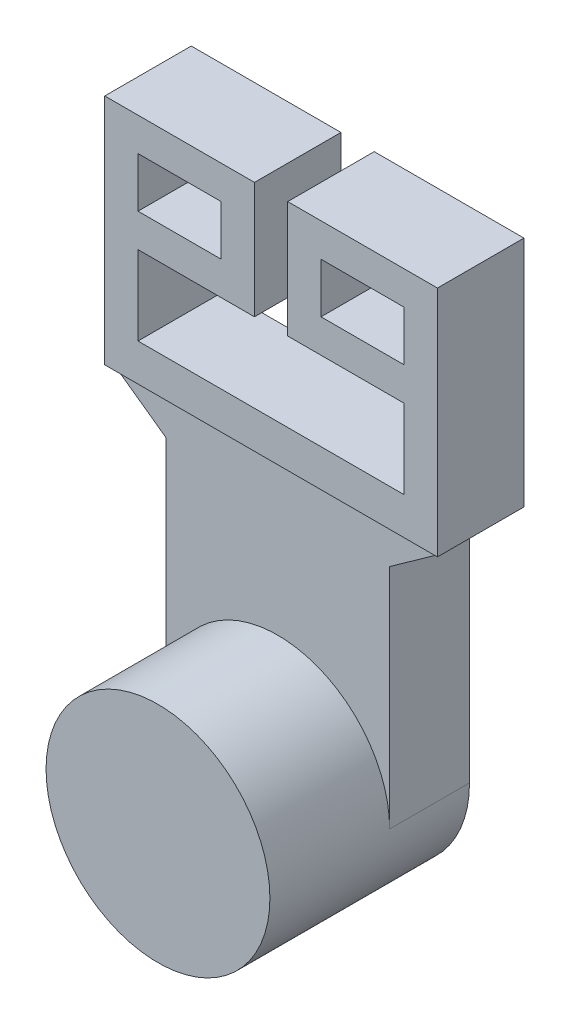
from build123d import *

# Parameters (mm, degrees)
SKETCH1_R           = 10.6807
BOSS_EXTRUDE1_DEPTH = 19.05
SKETCH2_W           = 21.3614
SKETCH2_H           = 25.4
BOSS_EXTRUDE2_DEPTH = 7.62
BOSS_EXTRUDE3_DEPTH = 3.556
SKETCH4_W           = 15.875
SKETCH4_H           = 22.225
BOSS_EXTRUDE4_DEPTH = 3.175
SKETCH5_W           = 15.875
SKETCH5_H           = 22.225
BOSS_EXTRUDE5_DEPTH = 3.175
SKETCH7_W           = 15.875
SKETCH7_H           = 11.1125
BOSS_EXTRUDE6_DEPTH = 11.1125
SKETCH8_W           = 15.875
SKETCH8_H           = 11.1125
BOSS_EXTRUDE7_DEPTH = 11.1125
SKETCH9_W           = 31.75
SKETCH9_H           = 22.225
CUT_EXTRUDE1_DEPTH  = 7.62
BOSS_EXTRUDE8_DEPTH = 7.62
CUT_EXTRUDE2_REACH  = 53.349
SKETCH11_W          = 7.9375
SKETCH11_H          = 4.7625


with BuildPart() as part:
    # Sketch1 → Boss-Extrude1 (new body)
    with BuildSketch(Plane.XY):
        with Locations(Location((0, 0, 0), (0, 0, 180))):
            Circle(SKETCH1_R)
    extrude(amount=BOSS_EXTRUDE1_DEPTH)

    # Sketch2 → Boss-Extrude2 (add)
    with BuildSketch(Plane(origin=(0, 0, 0), x_dir=(-1, 0, 0), z_dir=(0, 0, -1))):
        with Locations((0, 12.7)):
            Rectangle(SKETCH2_W, SKETCH2_H)
    extrude(amount=-BOSS_EXTRUDE2_DEPTH)

    # Sketch3 → Boss-Extrude3 (add)
    with BuildSketch(Plane(origin=(0, 25.4, 0), x_dir=(1, 0, 0), z_dir=(0, 1, 0))):
        Polygon((0, 0), (12.7, 0), (12.7, -15.875), (-12.7, -15.875), (-12.7, 0), align=None)
    extrude(amount=BOSS_EXTRUDE3_DEPTH)

    # Sketch4 → Boss-Extrude4 (add)
    with BuildSketch(Plane(origin=(12.7, 0, 0), x_dir=(0, 0, -1), z_dir=(1, 0, 0))):
        with Locations((-7.9375, 36.5125)):
            Rectangle(SKETCH4_W, SKETCH4_H)
    extrude(amount=BOSS_EXTRUDE4_DEPTH)

    # Sketch5 → Boss-Extrude5 (add)
    with BuildSketch(Plane.ZY.offset(12.7)):
        with Locations((7.9375, 36.5125)):
            Rectangle(SKETCH5_W, SKETCH5_H)
    extrude(amount=BOSS_EXTRUDE5_DEPTH)

    # Sketch7 → Boss-Extrude6 (add)
    with BuildSketch(Plane(origin=(-12.7, 0, 0), x_dir=(0, 0, -1), z_dir=(1, 0, 0))):
        with Locations((-7.9375, 42.06875)):
            Rectangle(SKETCH7_W, SKETCH7_H)
    extrude(amount=BOSS_EXTRUDE6_DEPTH)

    # Sketch8 → Boss-Extrude7 (add)
    with BuildSketch(Plane.ZY.offset(-12.7)):
        with Locations((7.9375, 42.06875)):
            Rectangle(SKETCH8_W, SKETCH8_H)
    extrude(amount=BOSS_EXTRUDE7_DEPTH)

    # Sketch9 → Cut-Extrude1 (cut)
    with BuildSketch(Plane.XY.offset(15.875)):
        with Locations((0, 36.5125)):
            Rectangle(SKETCH9_W, SKETCH9_H)
    extrude(amount=-CUT_EXTRUDE1_DEPTH, mode=Mode.SUBTRACT)

    # Sketch10 → Boss-Extrude8 (add)
    with BuildSketch(Plane(origin=(0, 0, 0), x_dir=(-1, 0, 0), z_dir=(0, 0, -1))):
        Polygon((-10.6807, 25.4), (-15.875, 25.4), (-10.6807, 21.684330036), align=None)
        Polygon((15.875, 25.4), (10.6807, 21.684330036), (10.6807, 25.4), align=None)
    extrude(amount=-BOSS_EXTRUDE8_DEPTH)

    # Sketch11 → Cut-Extrude2 (cut, up to next)
    with BuildSketch(Plane.XY.offset(8.255), mode=Mode.PRIVATE) as cut_extrude2_sk1:
        with Locations((8.73125, 42.06875)):
            Rectangle(SKETCH11_W, SKETCH11_H)
    cut_extrude2_tool1 = extrude(cut_extrude2_sk1.sketch, amount=-CUT_EXTRUDE2_REACH, mode=Mode.PRIVATE) & part.part
    # Sketch11 → Cut-Extrude2 (cut, up to next)
    with BuildSketch(Plane.XY.offset(8.255), mode=Mode.PRIVATE) as cut_extrude2_sk2:
        with Locations((-8.73125, 42.06875)):
            Rectangle(SKETCH11_W, SKETCH11_H)
    cut_extrude2_tool2 = extrude(cut_extrude2_sk2.sketch, amount=-CUT_EXTRUDE2_REACH, mode=Mode.PRIVATE) & part.part
    add(cut_extrude2_tool1.solids().sort_by_distance((8.73125, 42.06875, 8.255))[0], mode=Mode.SUBTRACT)
    add(cut_extrude2_tool2.solids().sort_by_distance((-8.73125, 42.06875, 8.255))[0], mode=Mode.SUBTRACT)


solid = part.part
